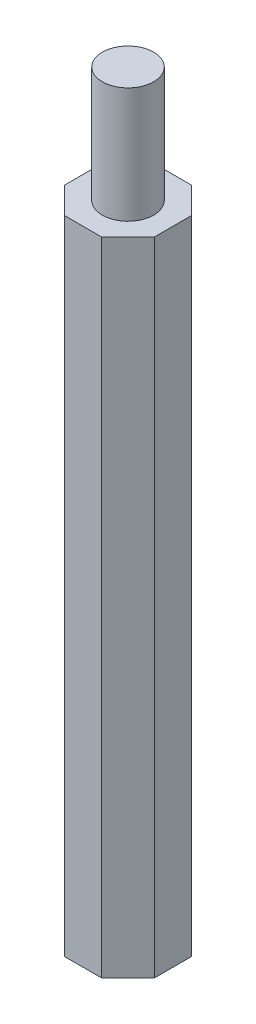
from build123d import *

# Parameters (mm, degrees)
EXTRUSION1_DEPTH        = 25
ESQUISSE2_R             = 2
EXTRUSION2_DEPTH        = 9
ESQUISSE3_R             = 2
ENL_V_MAT_EXTRU_1_DEPTH = 9


with BuildPart() as part:
    # Esquisse1 → Extrusion1 (new, symmetric)
    with BuildSketch(Plane(origin=(0, 0, 0), x_dir=(1, 0, 0), z_dir=(0, 1, 0))):
        Polygon((-1.449747468, 3.5), (1.449747468, 3.5), (3.5, 1.449747468), (3.5, -1.449747468), (1.449747468, -3.5), (-1.449747468, -3.5), (-3.5, -1.449747468), (-3.5, 1.449747468), align=None)
    extrude(amount=EXTRUSION1_DEPTH, both=True)

    # Esquisse2 → Extrusion2 (add)
    with BuildSketch(Plane(origin=(0, 25, 0), x_dir=(1, 0, 0), z_dir=(0, 1, 0))):
        with Locations(Location((0, 0, 0), (0, 0, 270))):
            Circle(ESQUISSE2_R)
    extrude(amount=EXTRUSION2_DEPTH)

    # Esquisse3 → Enlèv. mat.-Extru.1 (cut)
    with BuildSketch(Plane.XZ.offset(25)):
        with Locations(Location((0, 0, 0), (0, 0, 90))):
            Circle(ESQUISSE3_R)
    extrude(amount=-ENL_V_MAT_EXTRU_1_DEPTH, mode=Mode.SUBTRACT)


solid = part.part
